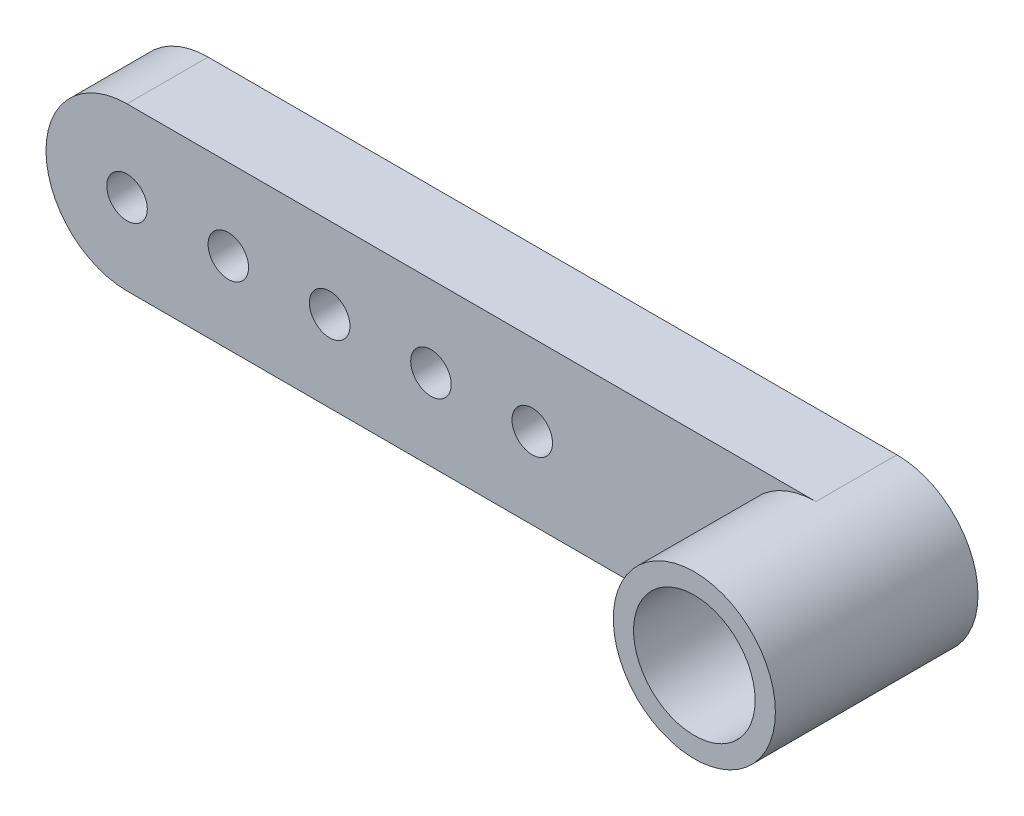
from build123d import *

# Parameters (mm, degrees)
EXTRUDE_1_DEPTH     = 2
SKETCH_3_R          = 2
EXTRUDE_2_DEPTH     = 3
SKETCH_4_R          = 1.5
CUT_EXTRUDE_1_DEPTH = 4
SKETCH_5_R          = 1
CUT_EXTRUDE_2_DEPTH = 4
SKETCH_6_R          = 0.5
CUT_EXTRUDE_3_DEPTH = 10


with BuildPart() as part:
    # 草图2 → 凸台-拉伸1 (new body)
    with BuildSketch(Plane.XY):
        with BuildLine():
            Line((-8.5, 2), (8.5, 2))
            ThreePointArc((8.5, 2), (10.5, 0), (8.5, -2))
            Line((8.5, -2), (-8.5, -2))
            ThreePointArc((-8.5, -2), (-10.5, 0), (-8.5, 2))
        make_face()
    extrude(amount=EXTRUDE_1_DEPTH)

    # 草图3 → 凸台-拉伸2 (add)
    with BuildSketch(Plane.XY.offset(2)):
        with Locations(Location((8.5, 0, 0), (0, 0, 90))):
            Circle(SKETCH_3_R)
    extrude(amount=EXTRUDE_2_DEPTH)

    # 草图4 → 切除-拉伸1 (cut)
    with BuildSketch(Plane.XY.offset(5)):
        with Locations((8.5, 0)):
            Circle(SKETCH_4_R)
    extrude(amount=-CUT_EXTRUDE_1_DEPTH, mode=Mode.SUBTRACT)

    # 草图5 → 切除-拉伸2 (cut)
    with BuildSketch(Plane.XY.offset(1)):
        with Locations((8.5, 0)):
            Circle(SKETCH_5_R)
    extrude(amount=-CUT_EXTRUDE_2_DEPTH, mode=Mode.SUBTRACT)

    # 草图6 → 切除-拉伸3 (cut)
    with BuildSketch(Plane(origin=(0, 0, 0), x_dir=(-1, 0, 0), z_dir=(0, 0, -1))):
        with Locations((-1.5, 0)):
            Circle(SKETCH_6_R)
        with Locations((1, 0)):
            Circle(SKETCH_6_R)
        with Locations((3.5, 0)):
            Circle(SKETCH_6_R)
        with Locations((6, 0)):
            Circle(SKETCH_6_R)
        with Locations((8.5, 0)):
            Circle(SKETCH_6_R)
    extrude(amount=-CUT_EXTRUDE_3_DEPTH, mode=Mode.SUBTRACT)


solid = part.part
